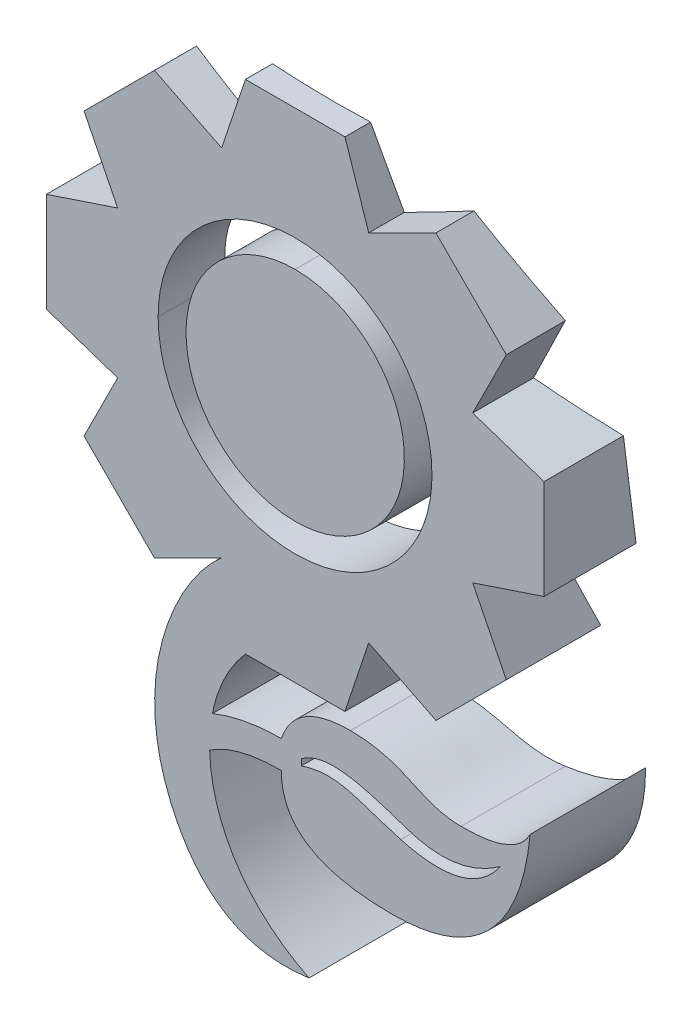
from build123d import *

# Parameters (mm, degrees)
RESSALTO_EXTRUS_O1_DEPTH        = 5
RESSALTO_EXTRUS_O1_2_DEPTH      = 5
ESBO_O6_R                       = 35.688832091
CORTE_EXTRUS_O3_DEPTH           = 77.48
CORTE_EXTRUS_O3_TAPER           = -7
CORTE_EXTRUS_O3_OTHER_WAY_DEPTH = 77.48
CORTE_EXTRUS_O3_OTHER_WAY_TAPER = 7


with BuildPart() as part:
    # Model → Ressalto-extrusão1 (new body)
    with BuildSketch(Plane.XY):
        with BuildLine():
            add(Edge.make_bspline(
                [(-3.800739803, 5.646175154), (-3.748445989, 3.49779825), (-2.542751075, 1.271391065), (0, 0)],
                knots=[0.399049767, 0.399049767, 0.399049767, 0.399049767, 1, 1, 1, 1], degree=3))
            add(Edge.make_bspline(
                [(0, 0), (-3.702321676, -0.528908633), (-5.288995899, 3.173400123)],
                knots=[1, 1, 1, 2, 2, 2], degree=2))
            add(Edge.make_bspline(
                [(-5.288995899, 3.173400123), (-6.87570888, 6.87570888), (-5.097922165, 10.745139329), (-3.342304654, 12.248304382)],
                knots=[2, 2, 2, 2, 3, 3, 3, 3], degree=3))
            Line((-3.342304654, 12.248304382), (-5.914397414, 10.962335517))
            Line((-5.914397414, 10.962335517), (-8.607258077, 13.654989473))
            Line((-8.607258077, 13.654989473), (-7.32116002, 16.227082234))
            Line((-7.32116002, 16.227082234), (-10.049121922, 17.136381336))
            Line((-10.049121922, 17.136381336), (-10.049121922, 20.944536415))
            Line((-10.049121922, 20.944536415), (-7.32116002, 21.853770922))
            Line((-7.32116002, 21.853770922), (-8.607141805, 24.425812006))
            Line((-8.607141805, 24.425812006), (-5.914500767, 27.118724345))
            Line((-5.914500767, 27.118724345), (-3.342304654, 25.832548773))
            Line((-3.342304654, 25.832548773), (-2.432953875, 28.560652786))
            Line((-2.432953875, 28.560652786), (1.375136608, 28.560652786))
            Line((1.375136608, 28.560652786), (2.284487387, 25.832652126))
            Line((2.284487387, 25.832652126), (4.856373442, 27.118620992))
            Line((4.856373442, 27.118620992), (7.549208266, 24.425915359))
            Line((7.549208266, 24.425915359), (6.263136048, 21.853874275))
            Line((6.263136048, 21.853874275), (8.991317575, 20.944536415))
            Line((8.991317575, 20.944536415), (8.991317575, 17.136381336))
            Line((8.991317575, 17.136381336), (6.263136048, 16.227030558))
            Line((6.263136048, 16.227030558), (7.54915659, 13.655092826))
            Line((7.54915659, 13.655092826), (4.856425118, 10.962206326))
            Line((4.856425118, 10.962206326), (2.284487387, 12.248304382))
            Line((2.284487387, 12.248304382), (1.375136608, 9.520226208))
            Line((1.375136608, 9.520226208), (-2.432953875, 9.520226208))
            add(Edge.make_bspline(
                [(-2.432953875, 9.520226208), (-3.082892378, 8.781657318), (-3.510062829, 7.878080283), (-3.696031109, 6.913183345)],
                knots=[0, 0, 0, 0, 0.279281286, 0.279281286, 0.279281286, 0.279281286], degree=3))
            add(Edge.make_bspline(
                [(-3.696031109, 6.913183345), (-2.499780782, 7.40462146), (-1.057837623, 7.404651441)],
                knots=[0.318418017, 0.318418017, 0.318418017, 1, 1, 1], degree=2))
            add(Edge.make_bspline(
                [(-1.057837623, 7.404651441), (-0.528908633, 8.991370555), (1.586700062, 8.991343413)],
                knots=[1, 1, 1, 2, 2, 2], degree=2))
            add(Edge.make_bspline(
                [(1.586700062, 8.991343413), (3.702308757, 8.991343413), (4.23121739, 7.933526146), (5.817917451, 7.933526146)],
                knots=[2, 2, 2, 2, 3, 3, 3, 3], degree=3))
            add(Edge.make_bspline(
                [(5.817917451, 7.933526146), (6.346800247, 7.933526146), (7.933526146, 7.933526146), (8.462408941, 8.991343413)],
                knots=[3, 3, 3, 3, 4, 4, 4, 4], degree=3))
            add(Edge.make_bspline(
                [(8.462408941, 8.991343413), (7.933526146, 3.702308757), (3.173400123, 3.702308757)],
                knots=[4, 4, 4, 5, 5, 5], degree=2))
            add(Edge.make_bspline(
                [(3.173400123, 3.702308757), (-1.057817267, 3.702308757), (-1.057817267, 6.346800247)],
                knots=[5, 5, 5, 6, 6, 6], degree=2))
            add(Edge.make_bspline(
                [(-1.057817267, 6.346800247), (-2.779578246, 6.346800247), (-3.800739803, 5.646175154)],
                knots=[6, 6, 6, 6.813847103, 6.813847103, 6.813847103], degree=2))
        make_face()
        with BuildLine():
            add(Edge.make_bspline(
                [(4.705064748, 19.023915947), (4.705064748, 21.917190865), (2.359599131, 24.262669402), (-0.533688706, 24.262669402), (-3.426989463, 24.262669402), (-5.772442161, 21.917190865), (-5.772442161, 19.023915947)],
                knots=[0, 0, 0, 0, 1, 1, 1, 2, 2, 2, 2], degree=3))
            add(Edge.make_bspline(
                [(-5.772442161, 19.023915947), (-5.772442161, 16.130589352), (-3.426989463, 13.785162492), (-0.533688706, 13.785162492), (2.359599131, 13.785162492), (4.705064748, 16.130589352), (4.705064748, 19.023915947)],
                knots=[2, 2, 2, 2, 3, 3, 3, 4, 4, 4, 4], degree=3))
        make_face(mode=Mode.SUBTRACT)
        with BuildLine():
            add(Edge.make_bspline(
                [(7.324441476, 7.355783252), (6.13381569, 5.628781585), (3.514438963, 6.343157056)],
                knots=[2, 2, 2, 3, 3, 3], degree=2))
            add(Edge.make_bspline(
                [(3.514438963, 6.343157056), (1.841955967, 6.79922771), (1.133187393, 7.355783252), (-0.295563549, 6.879532938)],
                knots=[3, 3, 3, 3, 4, 4, 4, 4], degree=3))
            Line((-0.295563549, 6.879532938), (-0.295563549, 7.117658095))
            add(Edge.make_bspline(
                [(-0.295563549, 7.117658095), (0.656937079, 7.832033566), (2.037396363, 7.408389895), (3.75256412, 6.81940737)],
                knots=[0, 0, 0, 0, 1, 1, 1, 1], degree=3))
            add(Edge.make_bspline(
                [(3.75256412, 6.81940737), (5.657565376, 6.165157467), (7.324441476, 7.355783252)],
                knots=[1, 1, 1, 2, 2, 2], degree=2))
        make_face(mode=Mode.SUBTRACT)
    extrude(amount=RESSALTO_EXTRUS_O1_DEPTH)


with BuildPart() as body_2:
    # Model → Ressalto-extrus_o1 2 (new body)
    with BuildSketch(Plane.XY):
        with BuildLine():
            add(Edge.make_bspline(
                [(-0.528908633, 14.864270463), (-2.835281004, 14.864270463), (-4.705116425, 16.734080046), (-4.705116425, 19.040452416), (-4.705116425, 21.34677311), (-2.835281004, 23.216698965), (-0.528908633, 23.216698965)],
                knots=[0, 0, 0, 0, 1, 1, 1, 2, 2, 2, 2], degree=3))
            add(Edge.make_bspline(
                [(-0.528908633, 23.216698965), (1.777463737, 23.216698965), (3.647299158, 21.34677311), (3.647299158, 19.040452416), (3.647299158, 16.734080046), (1.777463737, 14.864270463), (-0.528908633, 14.864270463)],
                knots=[2, 2, 2, 2, 3, 3, 3, 4, 4, 4, 4], degree=3))
        make_face()
    extrude(amount=RESSALTO_EXTRUS_O1_2_DEPTH)


with BuildPart() as corte_extrus_o3_tool:
    # Esboço6 → Corte-extrusão3 (new body)
    with BuildSketch(Plane(origin=(0, 20, 0), x_dir=(1, 0, 0), z_dir=(0, 1, 0))):
        with Locations((0, 32.695791475)):
            Circle(ESBO_O6_R)
    extrude(amount=CORTE_EXTRUS_O3_DEPTH, taper=CORTE_EXTRUS_O3_TAPER)


with BuildPart() as part_1:
    add(part.part)

    # Corte-extrusão3: cut by corte_extrus_o3_tool
    add(corte_extrus_o3_tool.part, mode=Mode.SUBTRACT)


with BuildPart() as body_2_1:
    add(body_2.part)

    # Corte-extrusão3: cut by corte_extrus_o3_tool
    add(corte_extrus_o3_tool.part, mode=Mode.SUBTRACT)


with BuildPart() as corte_extrus_o3_other_way_tool:
    # Esboço6 → Corte-extrusão3 other way (new body)
    with BuildSketch(Plane(origin=(0, 20, 0), x_dir=(1, 0, 0), z_dir=(0, 1, 0))):
        with Locations((0, 32.695791475)):
            Circle(ESBO_O6_R)
    extrude(amount=-CORTE_EXTRUS_O3_OTHER_WAY_DEPTH, taper=CORTE_EXTRUS_O3_OTHER_WAY_TAPER)


with BuildPart() as part_2:
    add(part_1.part)

    # Corte-extrusão3 other way: cut by corte_extrus_o3_other_way_tool
    add(corte_extrus_o3_other_way_tool.part, mode=Mode.SUBTRACT)


with BuildPart() as body_2_2:
    add(body_2_1.part)

    # Corte-extrusão3 other way: cut by corte_extrus_o3_other_way_tool
    add(corte_extrus_o3_other_way_tool.part, mode=Mode.SUBTRACT)


solid = Compound([part_2.part, body_2_2.part])
